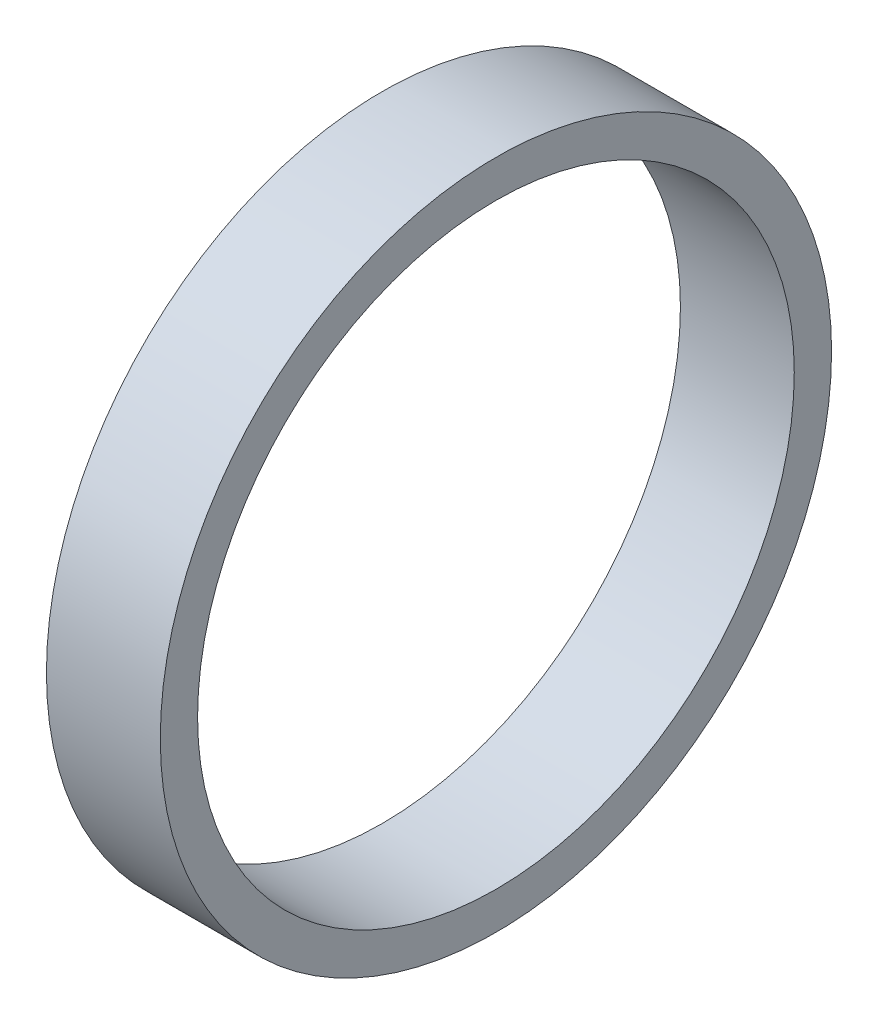
from build123d import *

# Parameters (mm, degrees)
SKETCH1_R      = 33.75
SKETCH1_R_2    = 30
EXTRUDE1_DEPTH = 5.725


with BuildPart() as part:
    # Sketch1 → Extrude1 (new, symmetric)
    with BuildSketch(Plane(origin=(0, 0, 0), x_dir=(0, 0, -1), z_dir=(1, 0, 0))):
        Circle(SKETCH1_R)
        Circle(SKETCH1_R_2, mode=Mode.SUBTRACT)
    extrude(amount=EXTRUDE1_DEPTH, both=True)


solid = part.part
